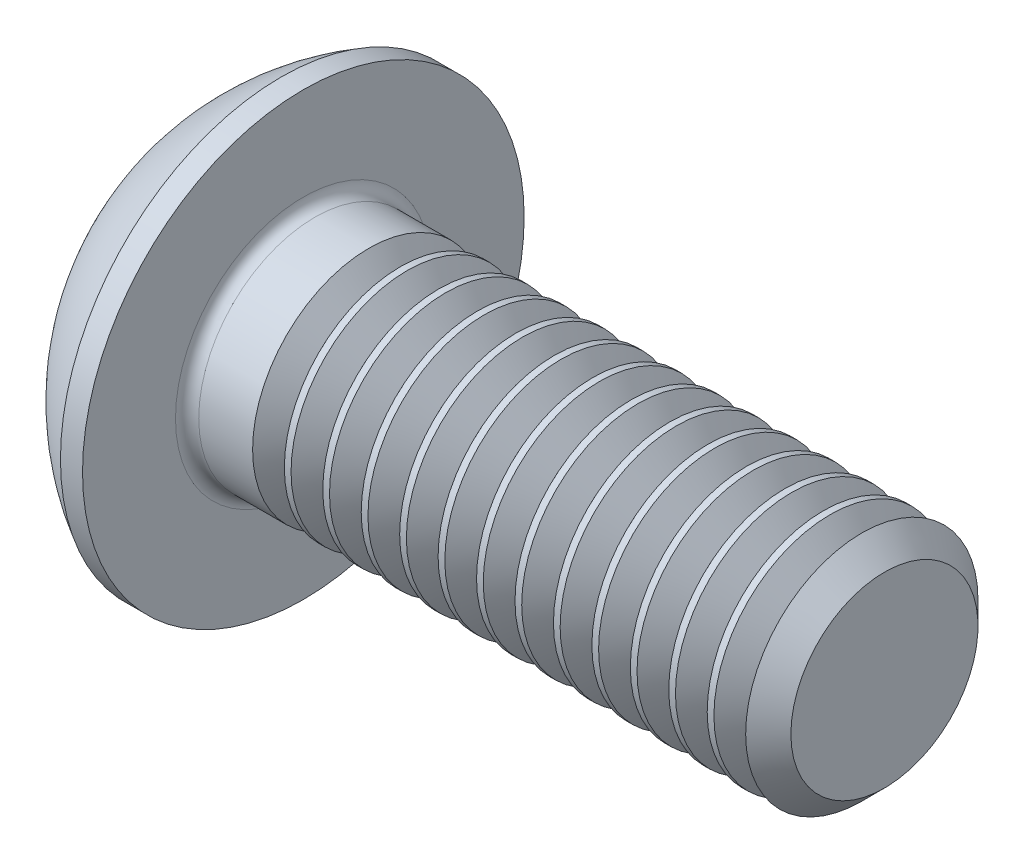
from build123d import *

# Parameters (mm, degrees)
FILLET1_R       = 0.2
HEX_2_DEPTH     = 1.3
THDSCHPAT_COUNT = 13
THDSCHPAT_PITCH = 0.661538462


with BuildPart() as part:
    # BodySke → BaseBody (revolve)
    with BuildSketch(Plane.XY, mode=Mode.PRIVATE) as basebody_sk:
        with BuildLine():
            Line((12.2, 0), (12.2, 1.61))
            Line((12.2, 1.61), (11.81, 2))
            Line((11.81, 2), (2.2, 2))
            Line((2.2, 2), (2.2, 3.8))
            Line((2.2, 3.8), (1.82, 3.8))
            ThreePointArc((1.82, 3.8), (0.762013659, 2.991755338), (0, 1.9))
            Line((0, 1.9), (0, 0))
            Line((0, 0), (12.2, 0))
        make_face()
    revolve(basebody_sk.sketch.rotate(Axis((0, 0, 0), (1, 0, 0)), 90), axis=Axis((0, 0, 0), (1, 0, 0)))

    # Fillet1
    fillet1_edges = [part.edges().sort_by_distance(p)[0] for p in [
        (2.2, 0, -2),
    ]]
    fillet(fillet1_edges, radius=FILLET1_R)

    # Sketch2 → PreBroach (revolve, cut)
    with BuildSketch(Plane.XY, mode=Mode.PRIVATE) as prebroach_sk:
        Polygon((0, 1.25), (1.3, 1.25), (2.021687836, 0), (0, 0), align=None)
    revolve(prebroach_sk.sketch.rotate(Axis((0, 0, 0), (1, 0, 0)), 90), axis=Axis((0, 0, 0), (1, 0, 0)), mode=Mode.SUBTRACT)

    # Sketch3 → Hex 2 (cut)
    with BuildSketch(Plane(origin=(0, 0, 0), x_dir=(0, 0, -1), z_dir=(1, 0, 0))):
        Polygon((-1.25, -0.721687836), (-1.25, 0.721687836), (0, 1.443375673), (1.25, 0.721687836), (1.25, -0.721687836), (0, -1.443375673), align=None)
    extrude(amount=HEX_2_DEPTH, mode=Mode.SUBTRACT)

    # ThdSchSke → ThreadSchematic (revolve, cut)
    with BuildSketch(Plane.XY, mode=Mode.PRIVATE) as threadschematic_sk:
        Polygon((3.6, -1.61), (3.32691906, -2), (3.32691906, -2.5), (3.87308094, -2.5), (3.87308094, -2), align=None)
    threadschematic = revolve(threadschematic_sk.sketch.rotate(Axis((-3.175, 0, 0), (1, 0, 0)), 270), axis=Axis((-3.175, 0, 0), (1, 0, 0)), mode=Mode.SUBTRACT)

    # ThdSchPat: ThreadSchematic ×13
    with Locations(*[(i * THDSCHPAT_PITCH, 0, 0) for i in range(1, THDSCHPAT_COUNT)]):
        add(threadschematic, mode=Mode.SUBTRACT)


solid = part.part
